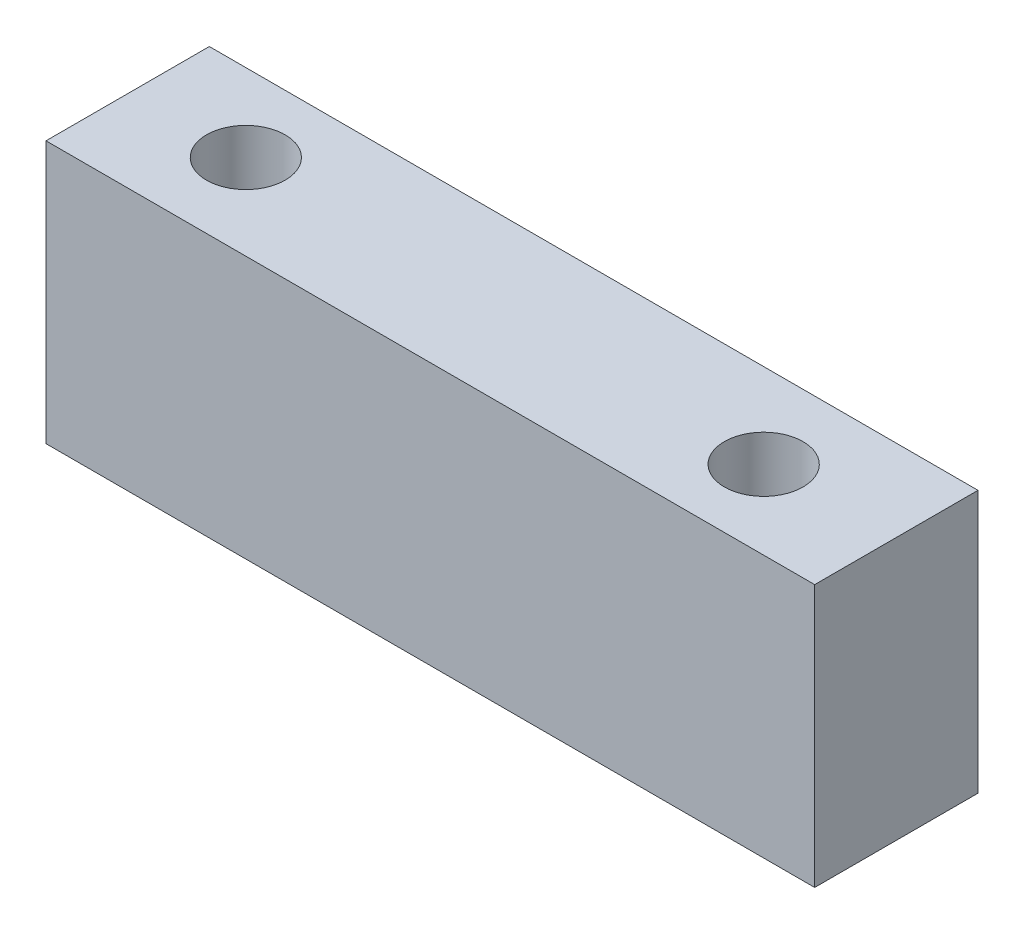
from build123d import *

# Parameters (mm, degrees)
SKETCH_1_W      = 29.304262276
SKETCH_1_H      = 6.226118048
SKETCH_1_R      = 1.5
EXTRUDE_1_DEPTH = 10


with BuildPart() as part:
    # 草图1 → 凸台-拉伸1 (new body)
    with BuildSketch(Plane(origin=(0, 0, 0), x_dir=(1, 0, 0), z_dir=(0, 1, 0))):
        with Locations((-10.135143535, 1.366626129)):
            Rectangle(SKETCH_1_W, SKETCH_1_H)
        with Locations(Location((-20.427282611, 1.511293125, 0), (0, 0, 270))):
            Circle(SKETCH_1_R, mode=Mode.SUBTRACT)
        with Locations(Location((-0.427282611, 1.253567105, 0), (0, 0, 270))):
            Circle(SKETCH_1_R, mode=Mode.SUBTRACT)
    extrude(amount=EXTRUDE_1_DEPTH)


solid = part.part
